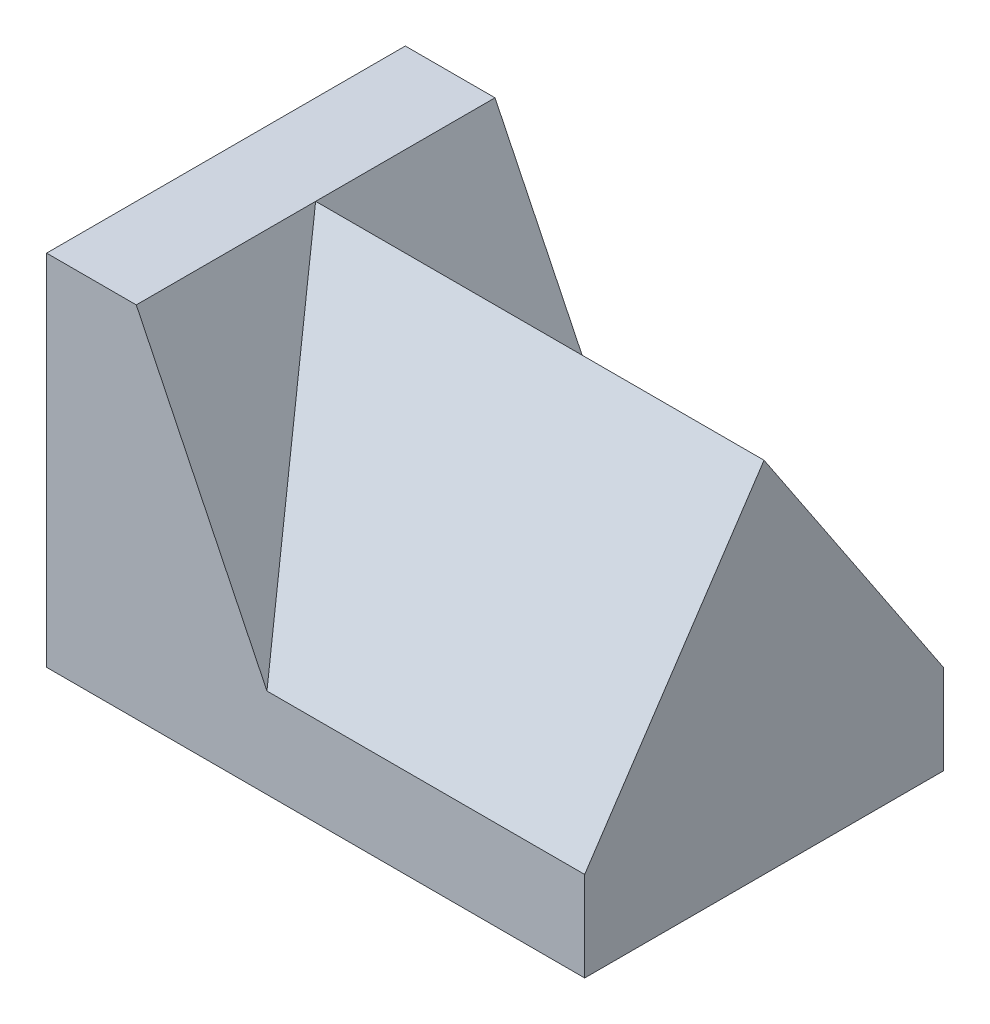
from build123d import *

# Parameters (mm, degrees)
SKETCH_1_W          = 30
SKETCH_1_H          = 20
EXTRUDE_1_DEPTH     = 20
CUT_EXTRUDE_4_DEPTH = 27.925824036
EXTRUDE_6_DEPTH     = 30


with BuildPart() as part:
    # 草圖1 → 填料-伸長1 (new body)
    with BuildSketch(Plane.XY):
        Rectangle(SKETCH_1_W, SKETCH_1_H)
    extrude(amount=EXTRUDE_1_DEPTH)

    # 草圖10 → 除料-伸長4 (cut, through all)
    with BuildSketch(Plane(origin=(0, 0, 0), x_dir=(-1, 0, 0), z_dir=(0, 0, -1))):
        Polygon((-15, -5), (2.714610503, -5), (10, 10), (-15, 10), align=None)
    extrude(amount=-CUT_EXTRUDE_4_DEPTH, mode=Mode.SUBTRACT)

    # 草圖11 → 填料-伸長6 (add)
    with BuildSketch(Plane.ZY.offset(15)):
        Polygon((0, -5), (10, 10), (20, -5), align=None)
    extrude(amount=-EXTRUDE_6_DEPTH)


solid = part.part
